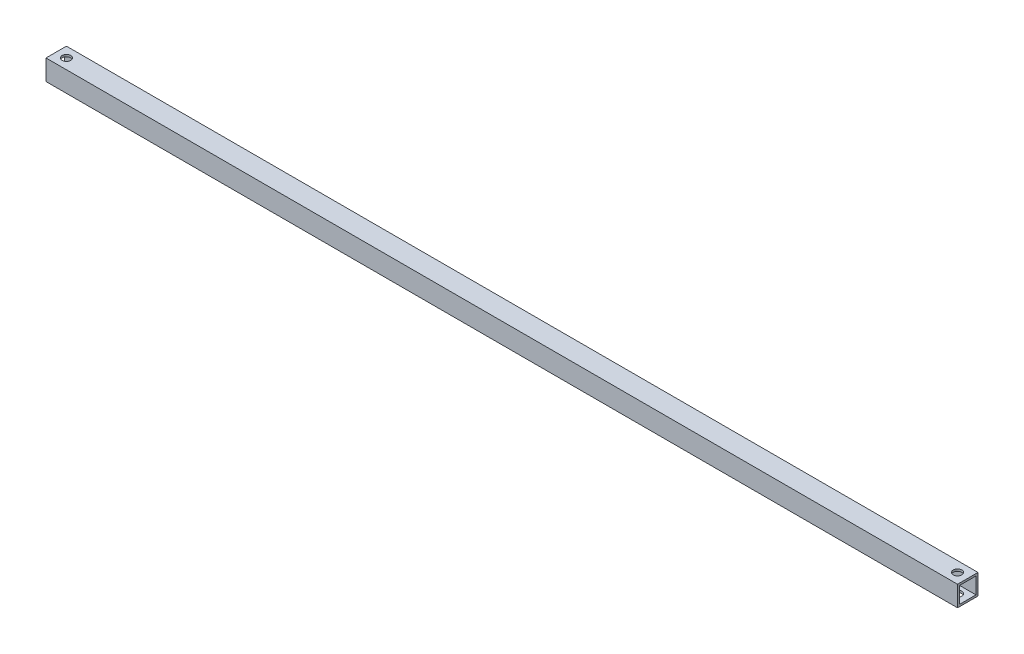
from build123d import *

# Parameters (mm, degrees)
SKETCH_1_W          = 10
SKETCH_1_H          = 10
SKETCH_1_W_2        = 8
SKETCH_1_H_2        = 8
EXTRUDE_1_DEPTH     = 445.586099411
SKETCH_2_R          = 2.1
CUT_EXTRUDE_1_DEPTH = 446.72634204


with BuildPart() as part:
    # ｽｹｯﾁ1 → 押し出し-薄板1 (new body)
    with BuildSketch(Plane(origin=(0, 0, 0), x_dir=(0, -1, 0), z_dir=(1, 0, 0))):
        Rectangle(SKETCH_1_W, SKETCH_1_H)
        Rectangle(SKETCH_1_W_2, SKETCH_1_H_2, mode=Mode.SUBTRACT)
    extrude(amount=EXTRUDE_1_DEPTH)

    # ｽｹｯﾁ2 → ｶｯﾄ - 押し出し1 (cut, through all)
    with BuildSketch(Plane(origin=(0, 5, 0), x_dir=(1, 0, 0), z_dir=(0, 1, 0))):
        with Locations(Location((5, 0, 0), (0, 0, 270))):
            Circle(SKETCH_2_R)
        with Locations(Location((440.586099411, 0, 0), (0, 0, 270))):
            Circle(SKETCH_2_R)
    extrude(amount=-CUT_EXTRUDE_1_DEPTH, mode=Mode.SUBTRACT)


solid = part.part
